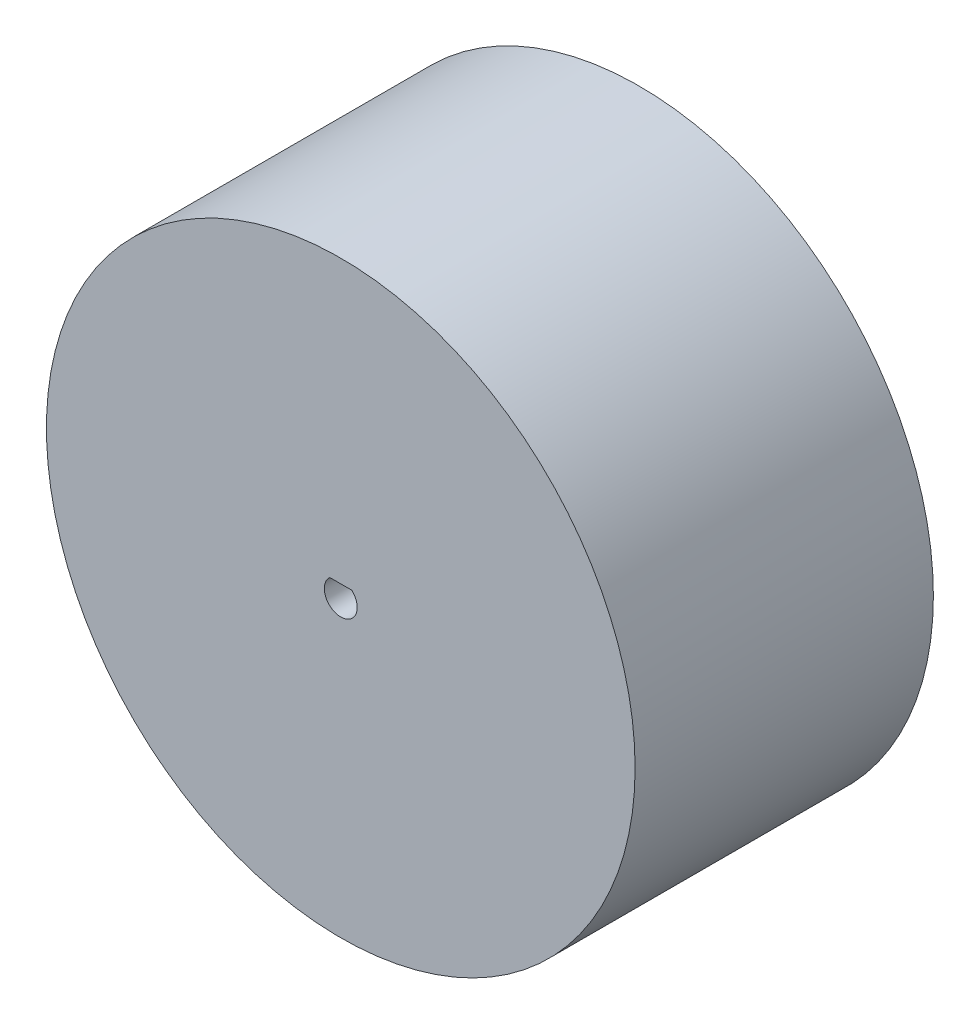
from build123d import *

# Parameters (mm, degrees)
SKETCH1_R               = 37.5
BOSS_EXTRUDE1_DEPTH     = 38
CUT_EXTRUDE1_DEPTH      = 66.24185773
CUT_EXTRUDE1_DEPTH_BACK = 66.24185773


with BuildPart() as part:
    # Sketch1 → Boss-Extrude1 (new body)
    with BuildSketch(Plane.XY):
        Circle(SKETCH1_R)
    extrude(amount=BOSS_EXTRUDE1_DEPTH)

    # Sketch2 → Cut-Extrude1 (cut, two sides: drawn at the far end of the back side and taken through both)
    with BuildSketch(Plane.XY.offset(38).offset(-CUT_EXTRUDE1_DEPTH_BACK)):
        with BuildLine():
            Line((-1.397, 1.561893482), (1.397, 1.561893482))
            ThreePointArc((1.397, 1.561893482), (0, -2.0955), (-1.397, 1.561893482))
        make_face()
    extrude(amount=CUT_EXTRUDE1_DEPTH + CUT_EXTRUDE1_DEPTH_BACK, mode=Mode.SUBTRACT)


solid = part.part
